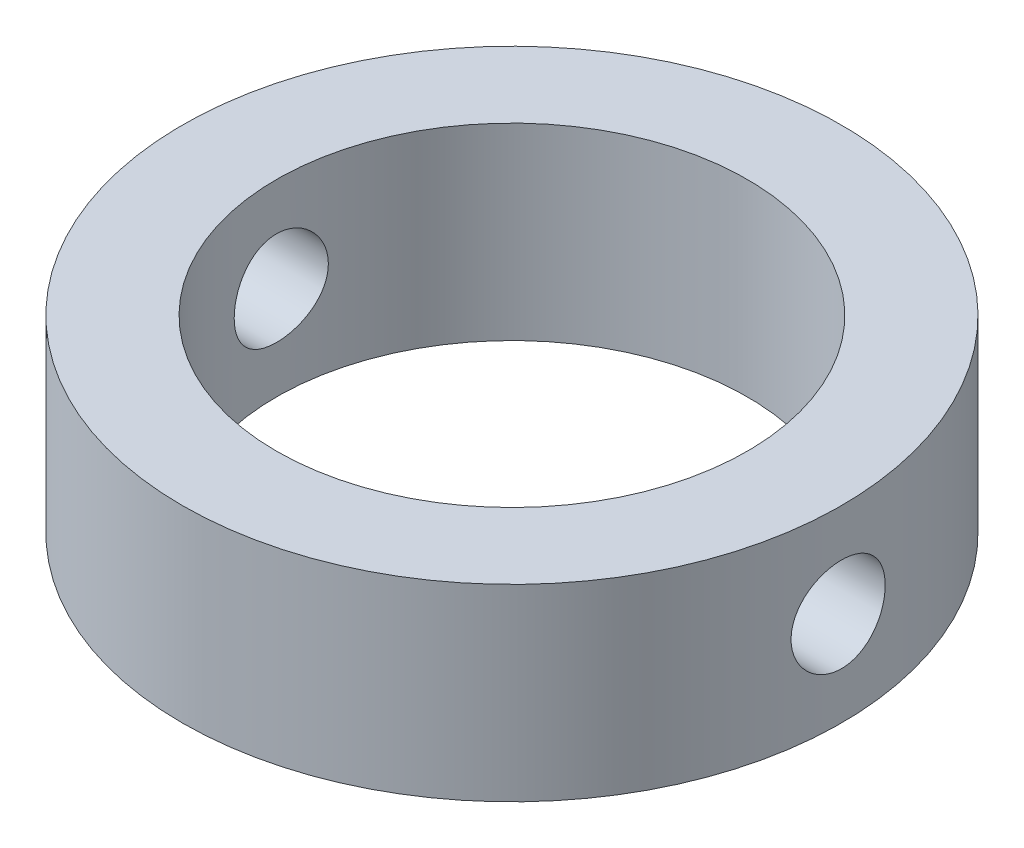
from build123d import *

# Parameters (mm, degrees)
SKETCH1_R           = 35
SKETCH1_R_2         = 25
BOSS_EXTRUDE1_DEPTH = 20
SKETCH2_R           = 5
CUT_EXTRUDE1_DEPTH  = 81.777472107


with BuildPart() as part:
    # Sketch1 → Boss-Extrude1 (new body)
    with BuildSketch(Plane(origin=(0, 0, 0), x_dir=(1, 0, 0), z_dir=(0, 1, 0))):
        with Locations(Location((0, 0, 0), (0, 0, 270))):
            Circle(SKETCH1_R)
        with Locations(Location((0, 0, 0), (0, 0, 270))):
            Circle(SKETCH1_R_2, mode=Mode.SUBTRACT)
    extrude(amount=BOSS_EXTRUDE1_DEPTH)

    # Sketch2 → Cut-Extrude1 (cut, through all)
    with BuildSketch(Plane(origin=(35, 0, 0), x_dir=(0, 0, -1), z_dir=(1, 0, 0))):
        with Locations((0, 10)):
            Circle(SKETCH2_R)
    extrude(amount=-CUT_EXTRUDE1_DEPTH, mode=Mode.SUBTRACT)


solid = part.part
